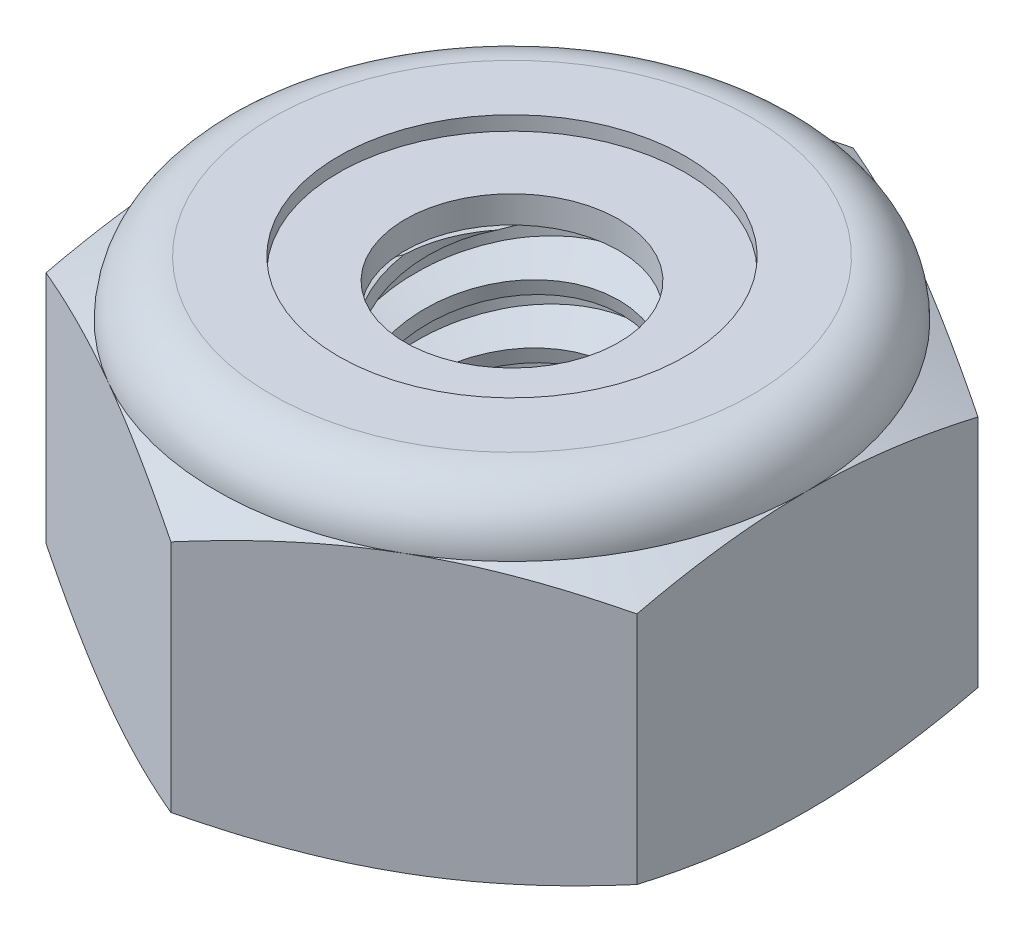
from build123d import *

# Parameters (mm, degrees)
EXTRUDE1_DEPTH       = 3.571875
SKETCH2_W            = 1.4224
SKETCH2_H            = 3.571875
LPATTERN1_COUNT      = 6
LPATTERN1_PITCH      = 0.635
LPATTERN1_COUNT_DIR2 = 2
LPATTERN1_PITCH_DIR2 = 0.635


with BuildPart() as part:
    # Sketch1 → Extrude1 (new body)
    with BuildSketch(Plane(origin=(0, 0, 0), x_dir=(1, 0, 0), z_dir=(0, 1, 0))):
        Polygon((0, 3.666174209), (-3.175, 1.833087105), (-3.175, -1.833087105), (0, -3.666174209), (3.175, -1.833087105), (3.175, 1.833087105), align=None)
    extrude(amount=EXTRUDE1_DEPTH)

    # Sketch4 → Cut-Revolve2 (revolve, cut)
    with BuildSketch(Plane(origin=(0, 0, 0), x_dir=(0, 0, -1), z_dir=(1, 0, 0))):
        Polygon((0, 3.571875), (1.4224, 3.571875), (1.147473684, 3.443674754), (1.147473684, 0.128200246), (1.4224, 0), (0, 0), align=None)
    revolve(axis=Axis((0, 3.571875, 0), (0, 1, 0)), mode=Mode.SUBTRACT)


with BuildPart() as body_2:
    # Sketch2 → Revolve1 (revolve)
    with BuildSketch(Plane(origin=(0, 0, 0), x_dir=(0, 0, -1), z_dir=(1, 0, 0))):
        with Locations((0.7112, 1.7859375)):
            Rectangle(SKETCH2_W, SKETCH2_H)
    revolve(axis=Axis((0, -1.4224, 0), (0, 1, 0)))

    # Sketch3 → Cut-Revolve1 (revolve, cut)
    with BuildSketch(Plane(origin=(0, 0, 0), x_dir=(0, 0, -1), z_dir=(1, 0, 0))):
        Polygon((1.439692084, 3.494406462), (1.560736676, 2.952126693), (1.182057853, 3.070921117), (1.147473684, 3.225858194), align=None)
    cut_revolve1 = revolve(axis=Axis((0, 3.571875, 0.152561988), (0, -0.9759815859905213, -0.21785303258717048)), mode=Mode.SUBTRACT)

    # LPattern1: Cut-Revolve1 6 × 2
    with Locations(*[Vector(0, -1, 0) * (i * LPATTERN1_PITCH) + Vector(0, 1, 0) * (j * LPATTERN1_PITCH_DIR2) for i in range(LPATTERN1_COUNT) for j in range(LPATTERN1_COUNT_DIR2) if (i, j) != (0, 0)]):
        add(cut_revolve1, mode=Mode.SUBTRACT)


with BuildPart() as part_1:
    add(part.part)

    # Combine1: cut body 2
    add(body_2.part, mode=Mode.SUBTRACT)

    # Sketch5 → Cut-Revolve3 (revolve, cut)
    with BuildSketch(Plane(origin=(0, 0, 0), x_dir=(0, 0, -1), z_dir=(1, 0, 0))):
        with BuildLine():
            Line((0, 0), (3.175, 0))
            Line((3.175, 0), (3.666174209, 0.229038295))
            Line((3.666174209, 0.229038295), (3.666174209, 2.747524205))
            Line((3.666174209, 2.747524205), (3.175, 2.9765625))
            ThreePointArc((3.175, 2.9765625), (3.000637006, 3.397512006), (2.5796875, 3.571875))
            Line((2.5796875, 3.571875), (2.5796875, 4.841875))
            Line((2.5796875, 4.841875), (4.936174209, 4.841875))
            Line((4.936174209, 4.841875), (4.936174209, -1.27))
            Line((4.936174209, -1.27), (0, -1.27))
            Line((0, -1.27), (0, 0))
        make_face()
    revolve(axis=Axis((0, 0, 0), (0, 1, 0)), mode=Mode.SUBTRACT)

    # Sketch6 → Cut-Revolve4 (revolve, cut)
    with BuildSketch(Plane(origin=(0, 0, 0), x_dir=(0, 0, -1), z_dir=(1, 0, 0))):
        with BuildLine():
            Line((0, 2.9765625), (3.0226, 2.9765625))
            ThreePointArc((3.0226, 2.9765625), (2.892873932, 3.289748932), (2.5796875, 3.419475))
            Line((2.5796875, 3.419475), (1.863580592, 3.419475))
            Line((1.863580592, 3.419475), (1.863580592, 4.841875))
            Line((1.863580592, 4.841875), (0, 4.841875))
            Line((0, 4.841875), (0, 2.9765625))
        make_face()
    revolve(axis=Axis((0, 4.841875, 0), (0, 1, 0)), mode=Mode.SUBTRACT)


with BuildPart() as body_2_2:
    # Sketch7 → Revolve2 (revolve)
    with BuildSketch(Plane(origin=(0, 0, 0), x_dir=(0, 0, -1), z_dir=(1, 0, 0))):
        with BuildLine():
            Line((1.147473684, 3.0527625), (2.938395763, 3.0527625))
            ThreePointArc((2.938395763, 3.0527625), (2.810484559, 3.261537543), (2.5796875, 3.343275))
            Line((2.5796875, 3.343275), (1.147473684, 3.343275))
            Line((1.147473684, 3.343275), (1.147473684, 3.0527625))
        make_face()
    revolve(axis=Axis((0, 3.0527625, 0), (0, 1, 0)))


solid = Compound([part_1.part, body_2_2.part])
